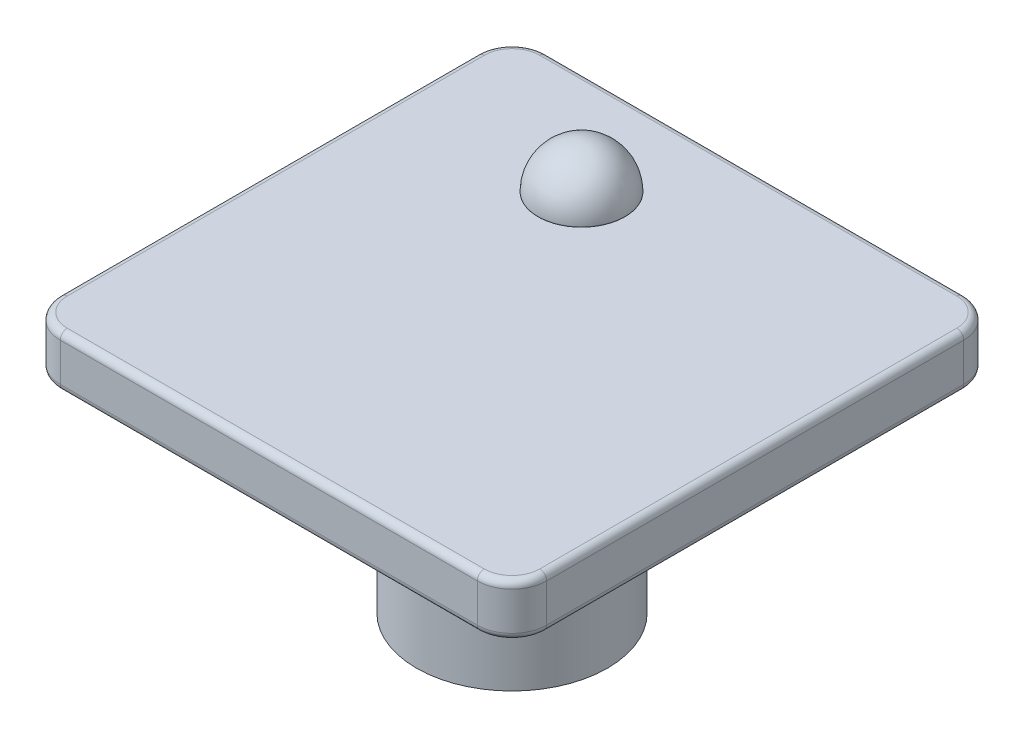
from build123d import *

# Parameters (mm, degrees)
BOSS_EXTRUDE1_DEPTH = 1.5
SKETCH2_R           = 2.75
BOSS_EXTRUDE2_DEPTH = 6
SKETCH3_W           = 1.1
SKETCH3_H           = 1.45
SKETCH3_W_2         = 1.45
SKETCH3_H_2         = 1.1
CUT_EXTRUDE1_DEPTH  = 6
CHAMFER1_SIZE       = 0.3
FILLET1_R           = 1
SKETCH4_R           = 1.25
BOSS_EXTRUDE3_DEPTH = 0.01
DOME1_FACE_RADIUS   = 1.25
DOME1_HEIGHT        = 1.25
FILLET3_R           = 0.2


with BuildPart() as part:
    # Sketch1 → Boss-Extrude1 (new body)
    with BuildSketch(Plane(origin=(0, 0, 0), x_dir=(1, 0, 0), z_dir=(0, 1, 0))):
        with BuildLine():
            Line((-7.324675649, 4.396717546), (4.675324351, 4.396717546))
            ThreePointArc((4.675324351, 4.396717546), (5.382431132, 4.103824327), (5.675324351, 3.396717546))
            Line((5.675324351, 3.396717546), (5.675324351, -8.603282454))
            ThreePointArc((5.675324351, -8.603282454), (5.382431132, -9.310389235), (4.675324351, -9.603282454))
            Line((4.675324351, -9.603282454), (-7.324675649, -9.603282454))
            ThreePointArc((-7.324675649, -9.603282454), (-8.03178243, -9.310389235), (-8.324675649, -8.603282454))
            Line((-8.324675649, -8.603282454), (-8.324675649, 3.396717546))
            ThreePointArc((-8.324675649, 3.396717546), (-8.03178243, 4.103824327), (-7.324675649, 4.396717546))
        make_face()
    extrude(amount=BOSS_EXTRUDE1_DEPTH)

    # Sketch2 → Boss-Extrude2 (add)
    with BuildSketch(Plane.XZ):
        with Locations(Location((-1.324675649, 2.603282454, 0), (0, 0, 270))):
            Circle(SKETCH2_R)
    extrude(amount=BOSS_EXTRUDE2_DEPTH)

    # Sketch3 → Cut-Extrude1 (cut)
    with BuildSketch(Plane.XZ.offset(6)):
        with Locations((-1.324675649, 3.878282454)):
            Rectangle(SKETCH3_W, SKETCH3_H)
        with Locations((-0.049675649, 2.603282454)):
            Rectangle(SKETCH3_W_2, SKETCH3_H_2)
        with Locations((-1.324675649, 2.603282454)):
            Rectangle(SKETCH3_W, SKETCH3_H_2)
        with Locations((-2.599675649, 2.603282454)):
            Rectangle(SKETCH3_W_2, SKETCH3_H_2)
        with Locations((-1.324675649, 1.328282454)):
            Rectangle(SKETCH3_W, SKETCH3_H)
    extrude(amount=-CUT_EXTRUDE1_DEPTH, mode=Mode.SUBTRACT)

    # Chamfer1
    chamfer1_edges = [part.edges().sort_by_distance(p)[0] for p in [
        (-0.774675649, -6, 3.878282454),
        (-0.049675649, -6, 3.153282454),
        (0.675324351, -6, 2.603282454),
        (-0.774675649, -6, 1.328282454),
        (-2.599675649, -6, 3.153282454),
        (-1.324675649, -6, 4.603282454),
        (-1.874675649, -6, 3.878282454),
        (-3.324675649, -6, 2.603282454),
        (-2.599675649, -6, 2.053282454),
        (-1.874675649, -6, 1.328282454),
        (-1.324675649, -6, 0.603282454),
        (-0.049675649, -6, 2.053282454),
    ]]
    chamfer(chamfer1_edges, length=CHAMFER1_SIZE)

    # Fillet1
    fillet1_edges = [part.edges().sort_by_distance(p)[0] for p in [
        (-1.324675649, 0, 5.353282454),
    ]]
    fillet(fillet1_edges, radius=FILLET1_R)

    # Sketch4 → Boss-Extrude3 (add)
    with BuildSketch(Plane(origin=(0, 1.5, 0), x_dir=(1, 0, 0), z_dir=(0, 1, 0))):
        with Locations(Location((-3.324675649, 1.396717546, 0), (0, 0, 90))):
            Circle(SKETCH4_R)
    extrude(amount=BOSS_EXTRUDE3_DEPTH)

    # Dome1: a dome of height H over a round flat face of radius A is a cap of a sphere of radius (A * A + H * H) / (2 * H)
    dome1_r = (DOME1_FACE_RADIUS * DOME1_FACE_RADIUS + DOME1_HEIGHT * DOME1_HEIGHT) / (2 * DOME1_HEIGHT)
    dome1_base = Plane((-3.324675649, 1.51, -1.396717546), z_dir=(0, 1, 0))
    with Locations(dome1_base.offset(DOME1_HEIGHT - dome1_r)):
        dome1_ball = Sphere(dome1_r, mode=Mode.PRIVATE)
    add(split(dome1_ball, bisect_by=dome1_base, keep=Keep.TOP, mode=Mode.PRIVATE))

    # Fillet3
    fillet3_edges = [part.edges().sort_by_distance(p)[0] for p in [
        (5.382431132, 1.5, 9.310389235),
        (-1.324675649, 0, 9.603282454),
        (-8.03178243, 0, 9.310389235),
        (5.675324351, 1.5, 2.603282454),
        (5.382431132, 1.5, -4.103824327),
        (-1.324675649, 1.5, -4.396717546),
        (-8.03178243, 1.5, -4.103824327),
        (-8.324675649, 1.5, 2.603282454),
        (-8.03178243, 1.5, 9.310389235),
        (-1.324675649, 1.5, 9.603282454),
        (-8.324675649, 0, 2.603282454),
        (-8.03178243, 0, -4.103824327),
        (-1.324675649, 0, -4.396717546),
        (5.382431132, 0, -4.103824327),
        (5.675324351, 0, 2.603282454),
        (5.382431132, 0, 9.310389235),
    ]]
    fillet(fillet3_edges, radius=FILLET3_R)


solid = part.part
